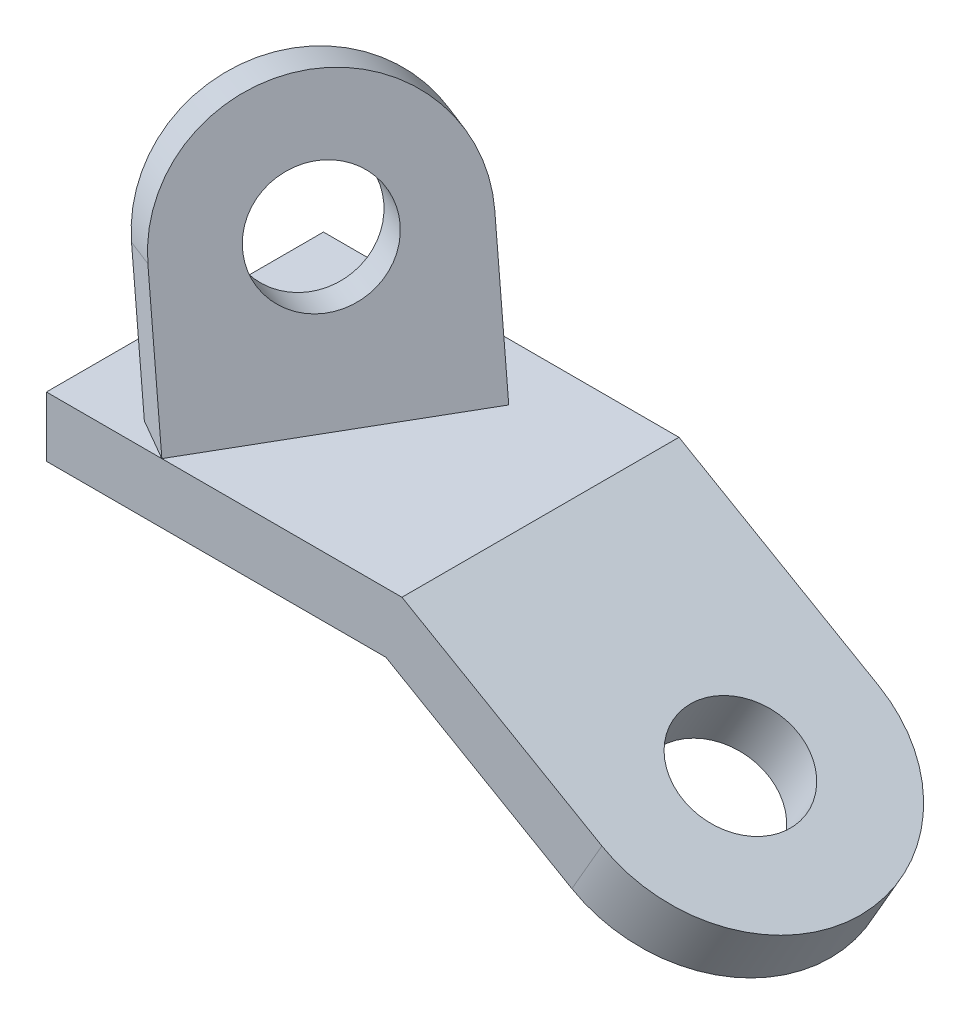
from build123d import *
from build123d.topology import SkipClean

# Parameters (mm, degrees)
BOSS_EXTRUDE1_DEPTH = 60
BOSS_EXTRUDE2_DEPTH = 13
CUT_EXTRUDE1_DEPTH  = 13
SKETCH7_R           = 12.5
BOSS_EXTRUDE5_DEPTH = 10


with BuildPart() as part:
    # Sketch1 → Boss-Extrude1 (new body)
    with BuildSketch(Plane.XY):
        Polygon((0, 0), (0, 13), (77, 13), (120.301270189, -12), (113.801270189, -23.258330249), (73.516660498, 0), align=None)
    extrude(amount=-BOSS_EXTRUDE1_DEPTH)

    # Sketch2 → Boss-Extrude2 (add)
    with BuildSketch(Plane(origin=(24.879165125, 43.091978046, 0), x_dir=(0.86602540378444, -0.49999999999999756, 0), z_dir=(0.49999999999999756, 0.86602540378444, 0))):
        with BuildLine():
            ThreePointArc((110.183956091, 0), (140.183956091, 30), (110.183956091, 60))
            Line((110.183956091, 60), (110.183956091, 42.5))
            ThreePointArc((110.183956091, 42.5), (119.022790856, 38.838834765), (122.683956091, 30))
            ThreePointArc((122.683956091, 30), (119.022790856, 21.161165235), (110.183956091, 17.5))
            Line((110.183956091, 17.5), (110.183956091, 0))
        make_face()
    extrude(amount=-BOSS_EXTRUDE2_DEPTH)

    # Sketch2<3> → Cut-Extrude1 (cut)
    with SkipClean():  # the faces are left unmerged after this step: merging them gives an invalid solid
        with BuildSketch(Plane(origin=(24.879165125, 43.091978046, 0), x_dir=(0.86602540378444, -0.49999999999999756, 0), z_dir=(0.49999999999999756, 0.86602540378444, 0))):
            with BuildLine():
                Line((110.183956091, 17.5), (110.183956091, 42.5))
                ThreePointArc((110.183956091, 42.5), (97.683956091, 30), (110.183956091, 17.5))
            make_face()
        extrude(amount=-CUT_EXTRUDE1_DEPTH, mode=Mode.SUBTRACT)

    # Sketch7 → Boss-Extrude5 (add)
    with SkipClean():  # the faces are left unmerged after this step: merging them gives an invalid solid
        with BuildSketch(Plane(origin=(20.308570723, 6.283493649, 11.725158774), x_dir=(0.5000000000000041, 0, -0.8660254037844363), z_dir=(0.8365163037378063, 0.25881904510251796, 0.4829629131445385))):
            with BuildLine():
                Line((12.5, 38.953439041), (12.5, 6.953439041))
                Line((12.5, 6.953439041), (67.5, 6.953439041))
                Line((67.5, 6.953439041), (67.5, 38.953439041))
                ThreePointArc((67.5, 38.953439041), (40, 66.453439041), (12.5, 38.953439041))
            make_face()
            with Locations((40, 38.953439041)):
                Circle(SKETCH7_R, mode=Mode.SUBTRACT)
        extrude(amount=-BOSS_EXTRUDE5_DEPTH)


solid = part.part
